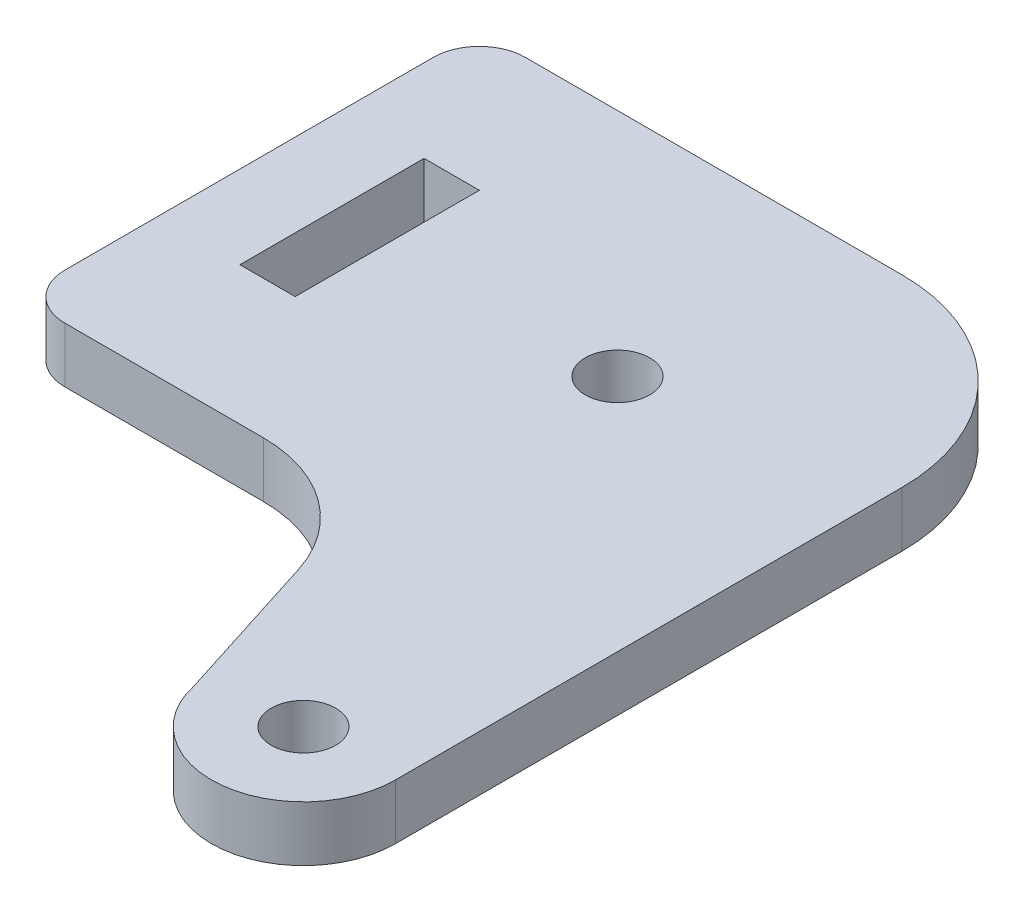
from build123d import *

# Parameters (mm, degrees)
SKETCH1_R           = 1.75
SKETCH1_W           = 3
SKETCH1_H           = 10
BOSS_EXTRUDE1_DEPTH = 3


with BuildPart() as part:
    # Sketch1 → Boss-Extrude1 (new body)
    with BuildSketch(Plane(origin=(0, 0, 0), x_dir=(1, 0, 0), z_dir=(0, 1, 0))):
        with BuildLine():
            Line((-32.051716829, -25), (-32.051716829, 2.5))
            ThreePointArc((-32.051716829, 2.5), (-34.980649017, 9.571067812), (-42.051716829, 12.5))
            Line((-42.051716829, 12.5), (-62.5, 12.5))
            ThreePointArc((-62.5, 12.5), (-64.267766953, 11.767766953), (-65, 10))
            Line((-65, 10), (-65, -10))
            ThreePointArc((-65, -10), (-64.267766953, -11.767766953), (-62.5, -12.5))
            Line((-62.5, -12.5), (-51.731989821, -12.5))
            ThreePointArc((-51.731989821, -12.5), (-47.304406502, -13.946364237), (-44.584529361, -17.727598413))
            Line((-44.584529361, -17.727598413), (-41.943571372, -26.034291608))
            ThreePointArc((-41.943571372, -26.034291608), (-36.531751789, -29.972890141), (-32.051716829, -25))
        make_face()
        with Locations(Location((-45, 0, 0), (0, 0, 270))):
            Circle(SKETCH1_R, mode=Mode.SUBTRACT)
        with Locations(Location((-37.051716829, -25, 0), (0, 0, 270))):
            Circle(SKETCH1_R, mode=Mode.SUBTRACT)
        with Locations((-59, 0)):
            Rectangle(SKETCH1_W, SKETCH1_H, mode=Mode.SUBTRACT)
    extrude(amount=BOSS_EXTRUDE1_DEPTH)


solid = part.part
